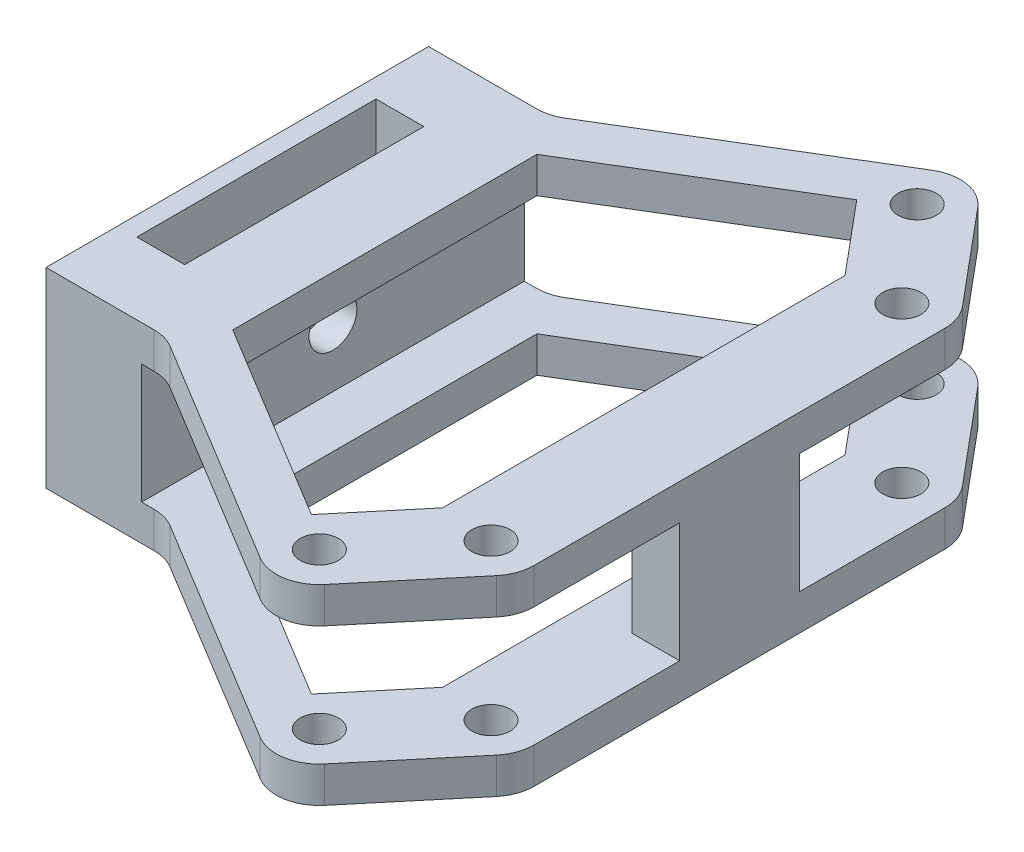
from build123d import *

# Parameters (mm, degrees)
SKETCH1_R               = 4
SKETCH1_W               = 10
SKETCH1_H               = 50
BOSS_EXTRUDE2_DEPTH     = 20
CUT_EXTRUDE1_DEPTH      = 129.597239473
CUT_EXTRUDE1_DEPTH_BACK = 129.597239473
SKETCH4_W               = 85
SKETCH4_H               = 25
SKETCH5_W               = 25
SKETCH5_H               = 25
BOSS_EXTRUDE4_DEPTH     = 10
HOLE1_D                 = 10
HOLE1_DEPTH             = 20
HOLE1_CBORE_D           = 24
HOLE1_CBORE_DEPTH       = 3


with BuildPart() as part:
    # Sketch1 → Boss-Extrude2 (new, symmetric)
    with BuildSketch(Plane(origin=(0, 0, 0), x_dir=(1, 0, 0), z_dir=(0, 1, 0))):
        with BuildLine():
            Line((74.989948747, 70.199605335), (27.241006815, 41.300394665))
            ThreePointArc((27.241006815, 41.300394665), (25, 40.331192469), (22.580955562, 40))
            Line((22.580955562, 40), (0, 40))
            Line((0, 40), (0, -40))
            Line((0, -40), (22.580955562, -40))
            ThreePointArc((22.580955562, -40), (25, -40.331192469), (27.241006815, -41.300394665))
            Line((27.241006815, -41.300394665), (74.989948747, -70.199605335))
            ThreePointArc((74.989948747, -70.199605335), (81.12845593, -71.377734399), (86.553849817, -68.273807903))
            Line((86.553849817, -68.273807903), (102.903849817, -48.723807903))
            ThreePointArc((102.903849817, -48.723807903), (104.459747288, -46.02126616), (105, -42.95))
            Line((105, -42.95), (105, 42.95))
            ThreePointArc((105, 42.95), (104.459747288, 46.02126616), (102.903849817, 48.723807903))
            Line((102.903849817, 48.723807903), (86.553849817, 68.273807903))
            ThreePointArc((86.553849817, 68.273807903), (81.12845593, 71.377734399), (74.989948747, 70.199605335))
        make_face()
        with Locations(Location((79.65, 62.5, 0), (0, 0, 270))):
            Circle(SKETCH1_R, mode=Mode.SUBTRACT)
        with Locations(Location((96, 42.95, 0), (0, 0, 270))):
            Circle(SKETCH1_R, mode=Mode.SUBTRACT)
        with Locations(Location((96, -42.95, 0), (0, 0, 270))):
            Circle(SKETCH1_R, mode=Mode.SUBTRACT)
        with Locations(Location((79.65, -62.5, 0), (0, 0, 270))):
            Circle(SKETCH1_R, mode=Mode.SUBTRACT)
        Polygon((30.85, -31.795763765), (30.85, 31.795763765), (72.509340505, 57.009349846), (85, 42.074035282), (85, -42.074035282), (72.509340505, -57.009349846), align=None, mode=Mode.SUBTRACT)
        with Locations((9, 0)):
            Rectangle(SKETCH1_W, SKETCH1_H, mode=Mode.SUBTRACT)
    extrude(amount=BOSS_EXTRUDE2_DEPTH, both=True)

    # Sketch4 → Cut-Extrude1 (cut, two sides: drawn at the far end of the back side and taken through both)
    with BuildSketch(Plane.XY.offset(-CUT_EXTRUDE1_DEPTH_BACK)):
        with Locations((62.5, 0)):
            Rectangle(SKETCH4_W, SKETCH4_H)
    extrude(amount=CUT_EXTRUDE1_DEPTH + CUT_EXTRUDE1_DEPTH_BACK, mode=Mode.SUBTRACT)

    # Sketch5 → Boss-Extrude4 (add)
    with BuildSketch(Plane(origin=(105, 0, 0), x_dir=(0, 0, -1), z_dir=(1, 0, 0))):
        Rectangle(SKETCH5_W, SKETCH5_H)
    extrude(amount=-BOSS_EXTRUDE4_DEPTH)

    # Hole1
    with Locations(Plane.ZY):
        with Locations((0, 0)):
            CounterBoreHole(HOLE1_D / 2, HOLE1_CBORE_D / 2, HOLE1_CBORE_DEPTH, depth=HOLE1_DEPTH)


solid = part.part
